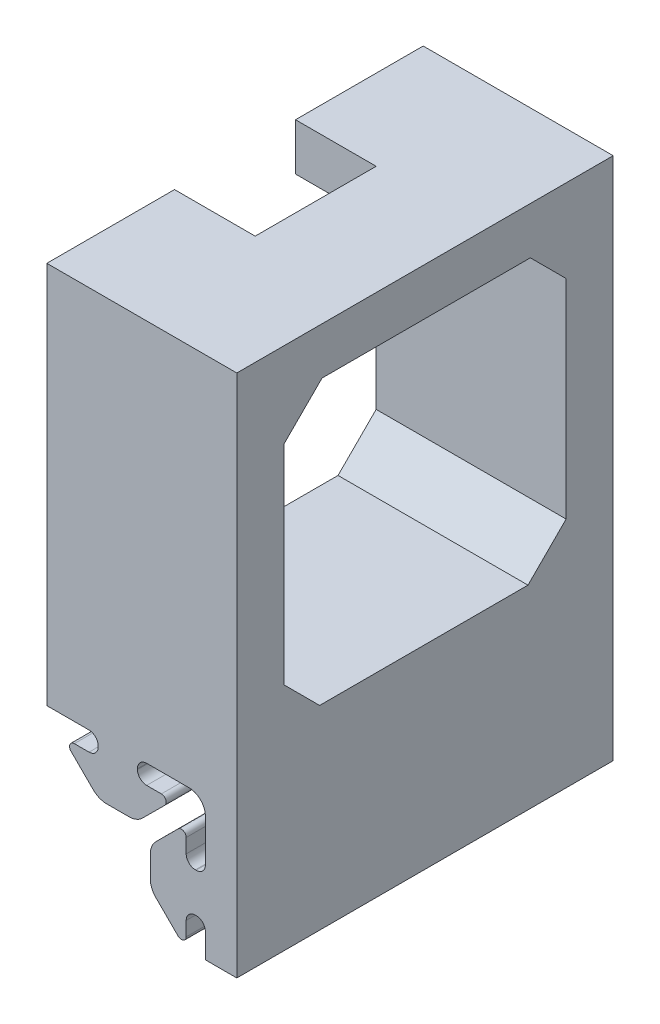
from build123d import *

# Parameters (mm, degrees)
BOSS_EXTRUDE1_DEPTH = 56
CUT_EXTRUDE1_DEPTH  = 56
CUT_EXTRUDE2_DEPTH  = 10


with BuildPart() as part:
    # Sketch1 → Boss-Extrude1 (new body)
    with BuildSketch(Plane.XY):
        with BuildLine():
            Line((13.02, -7.9417418), (17.7, -7.9417418))
            Line((17.7, -7.9417418), (17.7, 70.02))
            Line((17.7, 70.02), (-10.566443095, 70.02))
            Line((-10.566443095, 70.02), (-10.566443095, 13.02))
            Line((-10.566443095, 13.02), (-5.317126718, 13.02))
            Line((-5.317126718, 13.02), (-4.287512407, 13.02))
            ThreePointArc((-4.287512407, 13.02), (-3.319474451, 12.619025549), (-2.9185, 11.650987593))
            Line((-2.9185, 11.650987593), (-2.9185, 11.539212407))
            ThreePointArc((-2.9185, 11.539212407), (-3.319474451, 10.571174451), (-4.287512407, 10.1702))
            Line((-4.287512407, 10.1702), (-6.476788598, 10.1702))
            ThreePointArc((-6.476788598, 10.1702), (-7.136510935, 9.729114651), (-6.981020848, 8.950903446))
            Line((-6.981020848, 8.950903446), (-3.672257405, 5.649701928))
            ThreePointArc((-3.672257405, 5.649701928), (-2.746830644, 5.032499411), (-1.655778399, 4.8158))
            Line((-1.655778399, 4.8158), (1.655778399, 4.8158))
            ThreePointArc((1.655778399, 4.8158), (2.746830644, 5.032499411), (3.672257405, 5.649701928))
            Line((3.672257405, 5.649701928), (6.981020848, 8.950903446))
            ThreePointArc((6.981020848, 8.950903446), (7.136510935, 9.729114651), (6.476788598, 10.1702))
            Line((6.476788598, 10.1702), (4.287512407, 10.1702))
            ThreePointArc((4.287512407, 10.1702), (3.319474451, 10.571174451), (2.9185, 11.539212407))
            Line((2.9185, 11.539212407), (2.9185, 11.650987593))
            ThreePointArc((2.9185, 11.650987593), (3.319474451, 12.619025549), (4.287512407, 13.02))
            Line((4.287512407, 13.02), (6.332886163, 13.02))
            Line((6.332886163, 13.02), (10.562594215, 13.019824354))
            ThreePointArc((10.562594215, 13.019824354), (12.303594776, 12.313982883), (13.019956614, 10.577284622))
            Line((13.019956614, 10.577284622), (13.02, 4.287469289))
            ThreePointArc((13.02, 4.287469289), (12.619025549, 3.319431332), (11.650987593, 2.918456882))
            Line((11.650987593, 2.918456882), (11.539212407, 2.918456882))
            ThreePointArc((11.539212407, 2.918456882), (10.571174451, 3.319431332), (10.1702, 4.287469289))
            Line((10.1702, 4.287469289), (10.1702, 6.402089023))
            ThreePointArc((10.1702, 6.402089023), (9.733877283, 7.055496588), (8.963146507, 6.90287605))
            Line((8.963146507, 6.90287605), (5.667020993, 3.614283579))
            ThreePointArc((5.667020993, 3.614283579), (5.046449321, 2.687255303), (4.8285, 1.593185507))
            Line((4.8285, 1.593185507), (4.8285, -1.593185507))
            ThreePointArc((4.8285, -1.593185507), (5.046449321, -2.687255303), (5.667020993, -3.614283579))
            Line((5.667020993, -3.614283579), (8.963146507, -6.90287605))
            ThreePointArc((8.963146507, -6.90287605), (9.733877283, -7.055496588), (10.1702, -6.402089023))
            Line((10.1702, -6.402089023), (10.1702, -4.287469289))
            ThreePointArc((10.1702, -4.287469289), (10.571174451, -3.319431332), (11.539212407, -2.918456882))
            Line((11.539212407, -2.918456882), (11.650987593, -2.918456882))
            ThreePointArc((11.650987593, -2.918456882), (12.619025549, -3.319431332), (13.02, -4.287469289))
            Line((13.02, -4.287469289), (13.02, -5.3170836))
            Line((13.02, -5.3170836), (13.02, -7.9417418))
        make_face()
    extrude(amount=BOSS_EXTRUDE1_DEPTH)

    # Sketch14 → Cut-Extrude1 (cut)
    with BuildSketch(Plane(origin=(17.7, 0, 0), x_dir=(0, 0, -1), z_dir=(1, 0, 0))):
        Polygon((-43.675189669, 21.02), (-12.675189669, 21.02), (-7, 26.695189669), (-7, 57.695189669), (-12.324810331, 63.02), (-43.324810331, 63.02), (-49, 57.344810331), (-49, 26.344810331), align=None)
    extrude(amount=-CUT_EXTRUDE1_DEPTH, mode=Mode.SUBTRACT)

    # Sketch15 → Cut-Extrude2 (cut)
    with BuildSketch(Plane(origin=(0, 70.02, 0), x_dir=(1, 0, 0), z_dir=(0, 1, 0))):
        Polygon((-10.566443095, -19), (1.433556905, -19), (1.433556905, -37), (-10.566443095, -37), (-15.100276482, -37), (-15.100276482, -19), align=None)
    extrude(amount=-CUT_EXTRUDE2_DEPTH, mode=Mode.SUBTRACT)


solid = part.part
